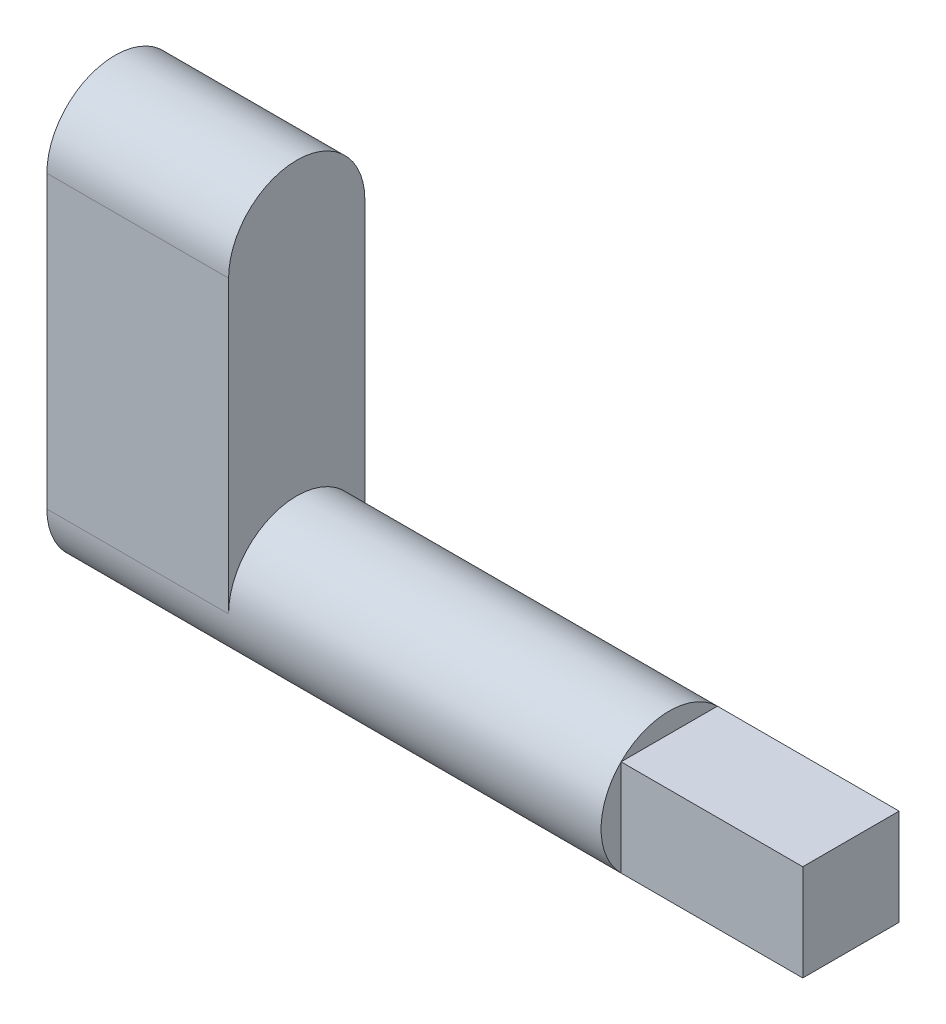
from build123d import *

# Parameters (mm, degrees)
SKETCH1_R           = 3.75
BOSS_EXTRUDE1_DEPTH = 30.5
SKETCH2_W           = 5.303300858
SKETCH2_H           = 5.303300858
BOSS_EXTRUDE2_DEPTH = 10
BOSS_EXTRUDE3_START = -10
BOSS_EXTRUDE3_DEPTH = 10


with BuildPart() as part:
    # Sketch1 → Boss-Extrude1 (new body)
    with BuildSketch(Plane(origin=(0, 0, 0), x_dir=(0, 0, -1), z_dir=(1, 0, 0))):
        Circle(SKETCH1_R)
    extrude(amount=-BOSS_EXTRUDE1_DEPTH)

    # Sketch2 → Boss-Extrude2 (add)
    with BuildSketch(Plane(origin=(0, 0, 0), x_dir=(0, 0, -1), z_dir=(1, 0, 0))):
        Rectangle(SKETCH2_W, SKETCH2_H)
    extrude(amount=BOSS_EXTRUDE2_DEPTH)

    # Sketch3 → Boss-Extrude3 (add)
    with BuildSketch(Plane.ZY.offset(30.5).offset(BOSS_EXTRUDE3_START)):
        with BuildLine():
            Line((-3.75, 0), (-3.75, 16))
            ThreePointArc((-3.75, 16), (0, 19.75), (3.75, 16))
            Line((3.75, 16), (3.75, 0))
            ThreePointArc((3.75, 0), (0, -3.75), (-3.75, 0))
        make_face()
    extrude(amount=BOSS_EXTRUDE3_DEPTH)


solid = part.part
